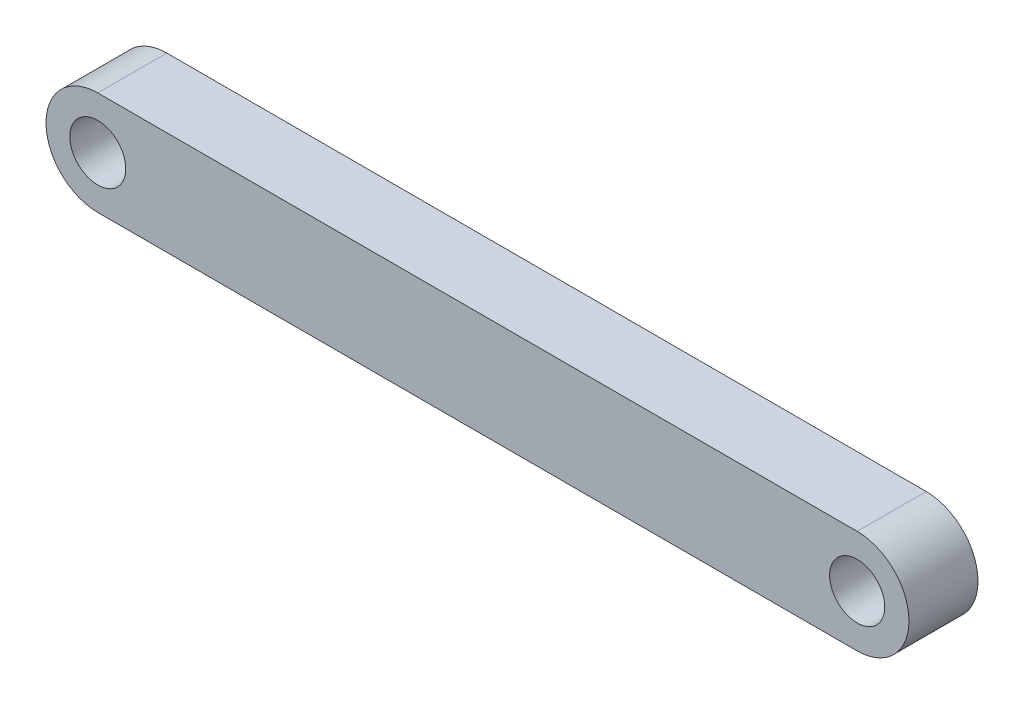
from build123d import *

# Parameters (mm, degrees)
CROQUIS1_R              = 4.052574427
CROQUIS1_R_2            = 3.991888558
SALIENTE_EXTRUIR1_DEPTH = 10


with BuildPart() as part:
    # Croquis1 → Saliente-Extruir1 (new body)
    with BuildSketch(Plane.XY):
        with BuildLine():
            Line((-55, 7.5), (55, 7.5))
            ThreePointArc((55, 7.5), (62.5, 0), (55, -7.5))
            Line((55, -7.5), (-55, -7.5))
            ThreePointArc((-55, -7.5), (-62.5, 0), (-55, 7.5))
        make_face()
        with Locations((-55, 0)):
            Circle(CROQUIS1_R, mode=Mode.SUBTRACT)
        with Locations((55, 0)):
            Circle(CROQUIS1_R_2, mode=Mode.SUBTRACT)
    extrude(amount=SALIENTE_EXTRUIR1_DEPTH)


solid = part.part
